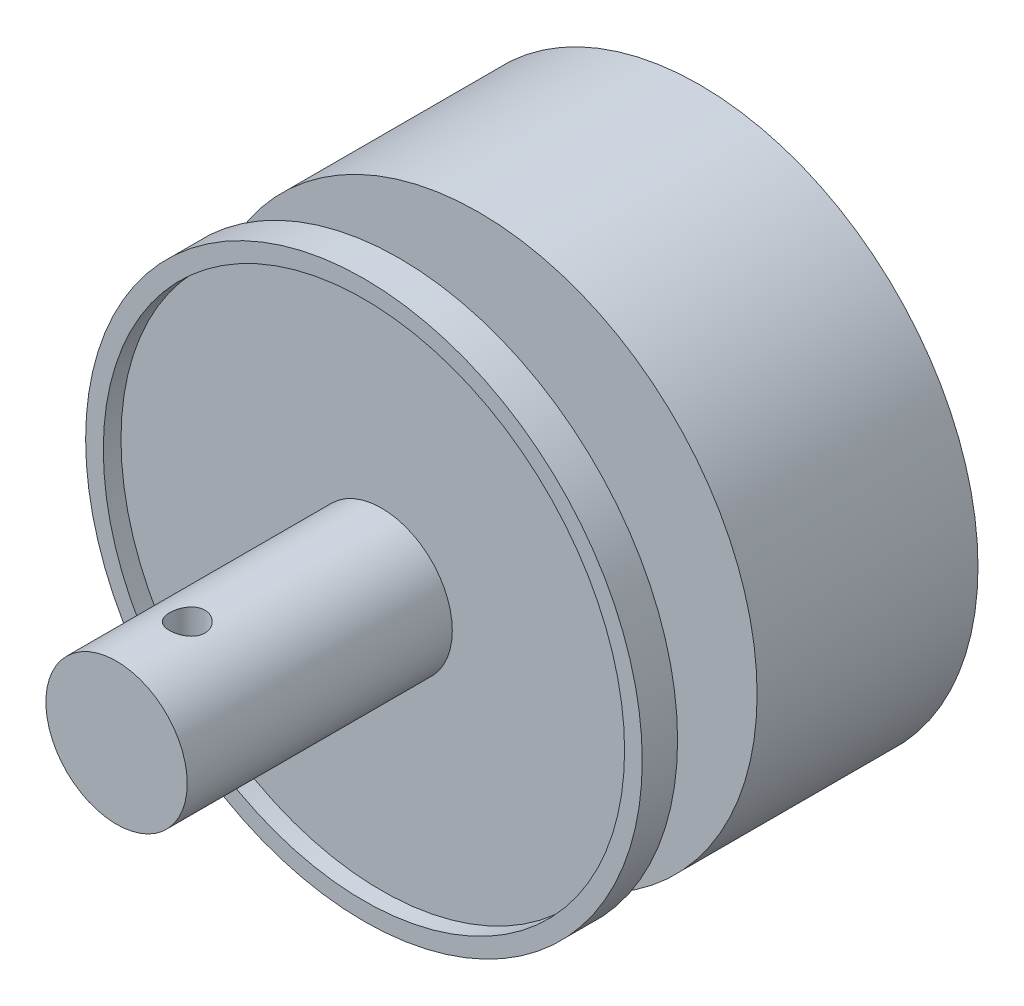
from build123d import *

# Parameters (mm, degrees)
SKETCH_1_R          = 31.5
EXTRUDE_1_DEPTH     = 25
SKETCH_2_R          = 5
EXTRUDE_2_DEPTH     = 9
SKETCH_3_R          = 31.5
EXTRUDE_3_DEPTH     = 4
SKETCH_4_R          = 29.5
CUT_EXTRUDE_1_DEPTH = 2
SKETCH_5_R          = 8
EXTRUDE_4_DEPTH     = 30
SKETCH_6_R          = 2
CUT_EXTRUDE_2_DEPTH = 20


with BuildPart() as part:
    # 草图1 → 凸台-拉伸1 (new body)
    with BuildSketch(Plane.XY):
        Circle(SKETCH_1_R)
    extrude(amount=EXTRUDE_1_DEPTH)

    # 草图2 → 凸台-拉伸2 (add)
    with BuildSketch(Plane.XY.offset(25)):
        Circle(SKETCH_2_R)
    extrude(amount=EXTRUDE_2_DEPTH)

    # 草图3 → 凸台-拉伸3 (add)
    with BuildSketch(Plane.XY.offset(34)):
        Circle(SKETCH_3_R)
    extrude(amount=EXTRUDE_3_DEPTH)

    # 草图4 → 切除-拉伸1 (cut)
    with BuildSketch(Plane.XY.offset(38)):
        Circle(SKETCH_4_R)
    extrude(amount=-CUT_EXTRUDE_1_DEPTH, mode=Mode.SUBTRACT)

    # 草图5 → 凸台-拉伸4 (add)
    with BuildSketch(Plane.XY.offset(36)):
        Circle(SKETCH_5_R)
    extrude(amount=EXTRUDE_4_DEPTH)

    # 草图6 → 切除-拉伸2 (cut, symmetric)
    with BuildSketch(Plane(origin=(0, 0, 0), x_dir=(1, 0, 0), z_dir=(0, 1, 0))):
        with Locations(Location((0, -58, 0), (0, 0, 270))):
            Circle(SKETCH_6_R)
    extrude(amount=CUT_EXTRUDE_2_DEPTH, both=True, mode=Mode.SUBTRACT)


solid = part.part
